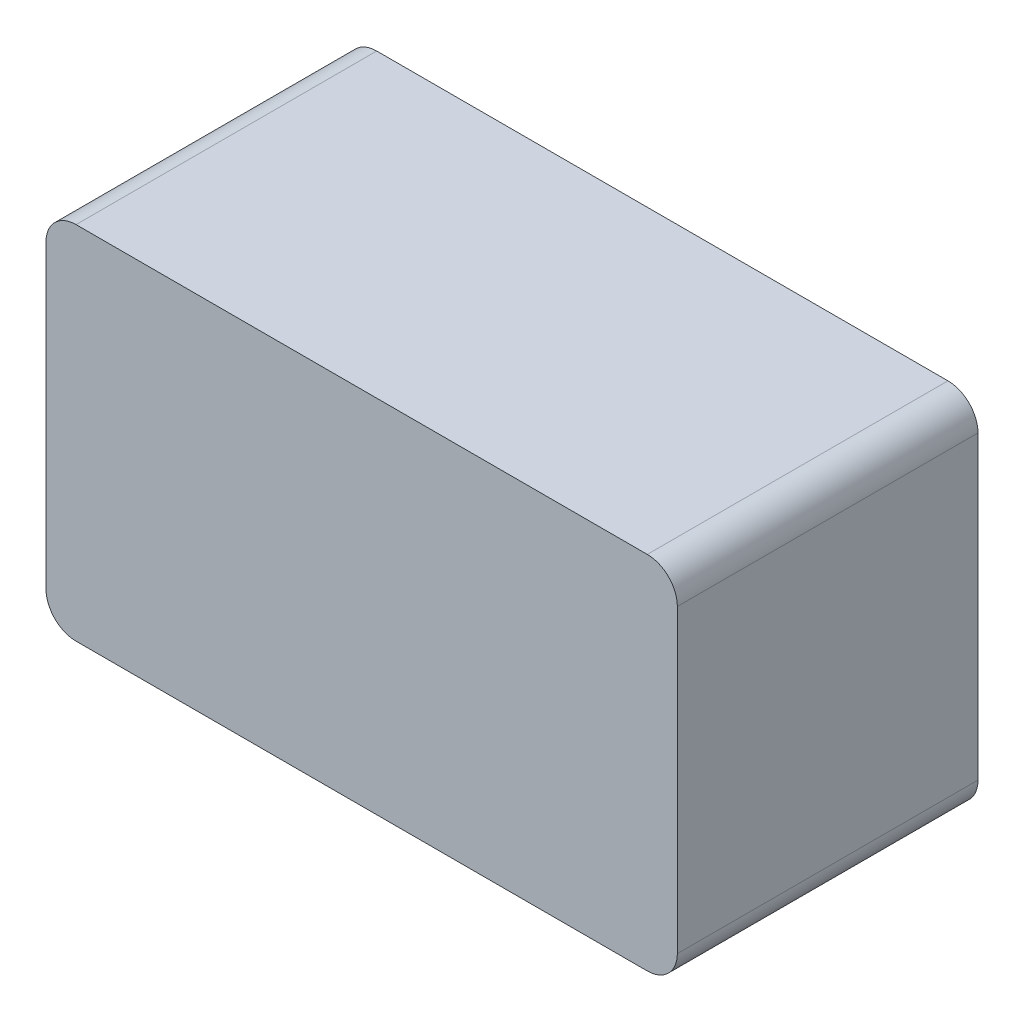
from build123d import *

# Parameters (mm, degrees)
BOSS_EXTRUDE2_DEPTH = 10
CUT_EXTRUDE3_DEPTH  = 1.6
SKETCH5_W           = 8.164929968
SKETCH5_H           = 9.761243885
CUT_EXTRUDE4_DEPTH  = 19.6
SKETCH6_R           = 1
CUT_EXTRUDE5_DEPTH  = 5


with BuildPart() as part:
    # Sketch2 → Boss-Extrude2 (new body)
    with BuildSketch(Plane.XY):
        with BuildLine():
            Line((-9.5, 6), (9.5, 6))
            ThreePointArc((9.5, 6), (10.207106781, 5.707106781), (10.5, 5))
            Line((10.5, 5), (10.5, -5))
            ThreePointArc((10.5, -5), (10.207106781, -5.707106781), (9.5, -6))
            Line((9.5, -6), (-9.5, -6))
            ThreePointArc((-9.5, -6), (-10.207106781, -5.707106781), (-10.5, -5))
            Line((-10.5, -5), (-10.5, 5))
            ThreePointArc((-10.5, 5), (-10.207106781, 5.707106781), (-9.5, 6))
        make_face()
    extrude(amount=BOSS_EXTRUDE2_DEPTH)

    # Sketch4 → Cut-Extrude3 (cut)
    with BuildSketch(Plane(origin=(0, 0, 0), x_dir=(-1, 0, 0), z_dir=(0, 0, -1))):
        with BuildLine():
            Line((-9.759787833, 5.35287298), (9.740212167, 5.35287298))
            ThreePointArc((9.740212167, 5.35287298), (9.810922845, 5.323583659), (9.840212167, 5.25287298))
            Line((9.840212167, 5.25287298), (9.840212167, -5.296629435))
            ThreePointArc((9.840212167, -5.296629435), (9.810922845, -5.367340113), (9.740212167, -5.396629435))
            Line((9.740212167, -5.396629435), (-9.759787833, -5.396629435))
            ThreePointArc((-9.759787833, -5.396629435), (-9.830498511, -5.367340113), (-9.859787833, -5.296629435))
            Line((-9.859787833, -5.296629435), (-9.859787833, 5.25287298))
            ThreePointArc((-9.859787833, 5.25287298), (-9.830498511, 5.323583659), (-9.759787833, 5.35287298))
        make_face()
    extrude(amount=-CUT_EXTRUDE3_DEPTH, mode=Mode.SUBTRACT)

    # Sketch5 → Cut-Extrude4 (cut)
    with BuildSketch(Plane.ZY.offset(9.8)):
        with Locations((5.717262672, 0.005392953)):
            Rectangle(SKETCH5_W, SKETCH5_H)
    extrude(amount=-CUT_EXTRUDE4_DEPTH, mode=Mode.SUBTRACT)

    # Sketch6 → Cut-Extrude5 (cut)
    with BuildSketch(Plane.XZ.offset(6)):
        with Locations(Location((0, 5, 0), (0, 0, 270))):
            Circle(SKETCH6_R)
    extrude(amount=-CUT_EXTRUDE5_DEPTH, mode=Mode.SUBTRACT)


solid = part.part
